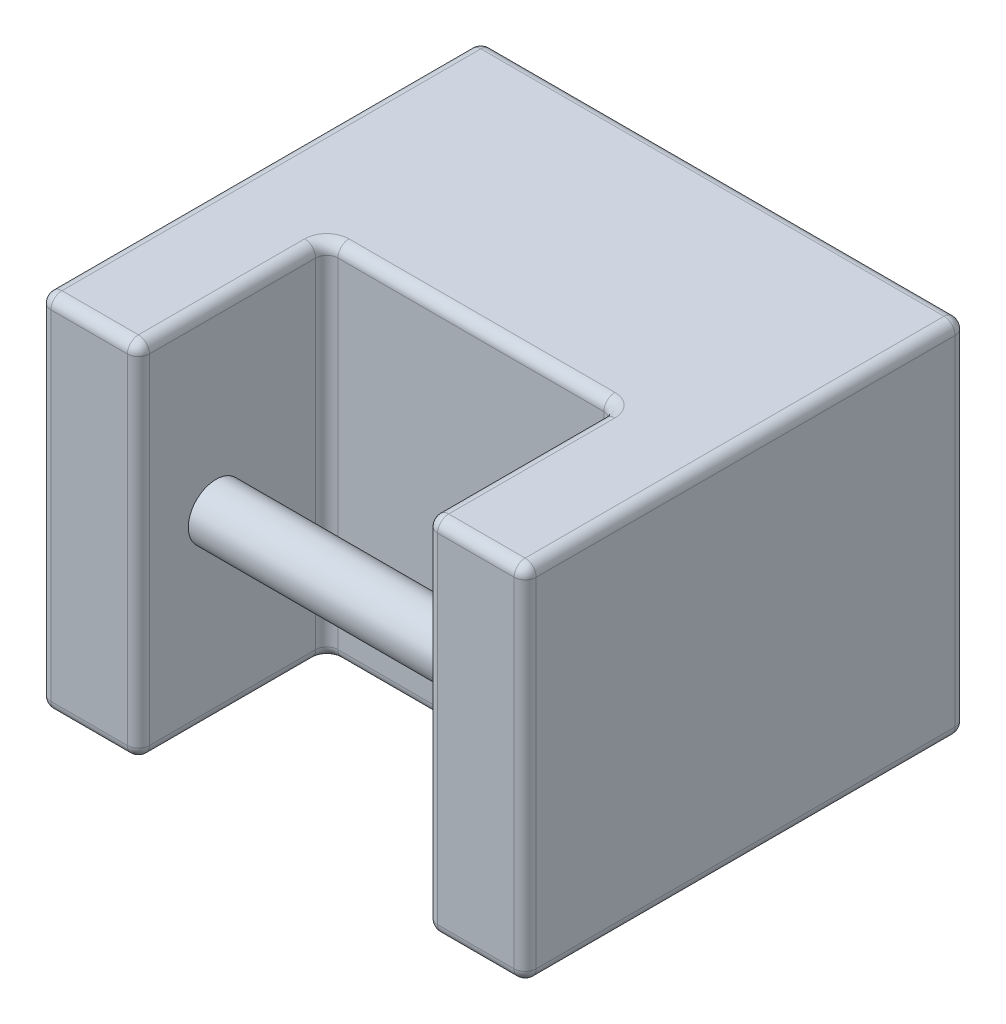
from build123d import *

# Parameters (mm, degrees)
SKETCH_1_W          = 219
SKETCH_1_H          = 163
EXTRUDE_1_DEPTH     = 199
SKETCH_2_W          = 130
SKETCH_2_H          = 170
CUT_EXTRUDE_1_DEPTH = 280.571547193
SKETCH_3_R          = 12.5
EXTRUDE_2_DEPTH     = 219
CUT_EXTRUDE_2_DEPTH = 0.1
FILLET_1_R          = 5


with BuildPart() as part:
    # 草图1 → 凸台-拉伸1 (new body)
    with BuildSketch(Plane.XY):
        Rectangle(SKETCH_1_W, SKETCH_1_H)
    extrude(amount=EXTRUDE_1_DEPTH)

    # 草图2 → 切除-拉伸1 (cut, through all)
    with BuildSketch(Plane.XZ.offset(81.5)):
        with Locations((0, 199)):
            Rectangle(SKETCH_2_W, SKETCH_2_H)
    extrude(amount=-CUT_EXTRUDE_1_DEPTH, mode=Mode.SUBTRACT)

    # 草图3 → 凸台-拉伸2 (add)
    with BuildSketch(Plane(origin=(109.5, 0, 0), x_dir=(0, 0, -1), z_dir=(1, 0, 0))):
        with Locations((-164, 0)):
            Circle(SKETCH_3_R)
    extrude(amount=-EXTRUDE_2_DEPTH)

    # 草图4 → 切除-拉伸2 (cut)
    # profile 1 of 4: a face of its own
    with BuildSketch(Plane.XZ.offset(81.5)):
        with BuildLine():
            Line((-46.175579134, 64.110809301), (-47.262304044, 64.110809301))
            add(Edge.make_bspline(
                [(-47.262304044, 64.110809301), (-47.284695529, 64.455227229), (-47.327383122, 65.111832742), (-47.371430886, 66.049536662), (-47.390032483, 66.891480143), (-47.408667005, 67.917907894), (-47.379927877, 69.212363046), (-47.302760911, 70.2549966), (-47.262304044, 70.80162541)],
                knots=[0, 0, 0, 0, 0.927540379, 1.768282303, 2.522502339, 3.190652681, 4.527123766, 6, 6, 6, 6], degree=3))
            add(Edge.make_bspline(
                [(-47.262304044, 70.80162541), (-47.234305367, 71.206857947), (-47.180159135, 71.99053123), (-47.037259081, 73.1199956), (-46.871880412, 74.166629537), (-46.656872478, 75.151066027), (-46.366361336, 76.11443546), (-45.952787301, 77.083419097), (-45.436982556, 78.091205736), (-44.827572962, 79.102519241), (-44.158906712, 80.056774708), (-43.408356598, 80.833306827), (-42.622844878, 81.425181075), (-41.787079057, 81.777436444), (-40.984622793, 81.996489034), (-40.25284843, 82.16879724), (-39.595254435, 82.289217385), (-39.179786853, 82.302068817), (-38.984017234, 82.308124452)],
                knots=[0, 0, 0, 0, 1.238521709, 2.395159043, 3.470603583, 4.46912877, 5.466066804, 6.534123646, 7.677244524, 8.916145015, 10.13365226, 11.221244199, 12.198275335, 13.109907183, 13.966820176, 14.733954848, 15.403435577, 16, 16, 16, 16], degree=3))
            add(Edge.make_bspline(
                [(-38.984017234, 82.308124452), (-38.734528731, 82.289728995), (-38.241547162, 82.253380141), (-37.51638493, 82.084965931), (-36.81602706, 81.842137789), (-35.9202457, 81.409566061), (-34.872773594, 80.731353242), (-33.981653898, 79.840747477), (-33.36502437, 79.025514382), (-32.930669333, 78.331687985), (-32.545762228, 77.556934341), (-32.062389328, 76.431190935), (-31.556714056, 74.937319176), (-31.192046889, 73.050548806), (-30.958231299, 71.091221763), (-30.851253207, 69.088199463), (-30.831361784, 67.104919224), (-30.947815118, 65.811456017), (-31.004047065, 65.186880045)],
                knots=[0, 0, 0, 0, 0.570779476, 1.127842599, 1.694919432, 2.261066821, 3.397481896, 4.527710891, 5.118384485, 5.730727279, 6.394748858, 7.092559246, 8.529363642, 9.986910621, 11.474321506, 13.03467297, 14.568129345, 16, 16, 16, 16], degree=3))
            add(Edge.make_bspline(
                [(-31.004047065, 65.186880045), (-31.118038133, 64.544419362), (-31.347721031, 63.249912384), (-31.842430831, 61.691343831), (-32.303803806, 60.50643007), (-32.689535826, 59.71241715), (-33.101686684, 59.009494464), (-33.69765435, 58.178218744), (-34.607774823, 57.234627881), (-35.451149938, 56.601844921), (-35.894309158, 56.269343288)],
                knots=[0, 0, 0, 0, 1.490916612, 3.004077927, 3.729534125, 4.397912905, 5.020560084, 5.590839424, 6.734084393, 8, 8, 8, 8], degree=3))
            Line((-35.894309158, 56.269343288), (-39.420838031, 54.04262264))
            add(Edge.make_bspline(
                [(-39.420838031, 54.04262264), (-39.870223805, 53.737540289), (-40.722344995, 53.159045928), (-41.860162032, 52.214102588), (-42.815169182, 51.218444241), (-43.537013387, 50.117540691), (-44.097654981, 48.984314995), (-44.595486873, 47.846445605), (-44.971324645, 46.592251649), (-45.238635077, 45.468082304), (-45.420931948, 44.523949177), (-45.5122481, 43.865490597), (-45.586430112, 43.283536846), (-45.595838875, 42.919867999), (-45.600254182, 42.749206915)],
                knots=[0, 0, 0, 0, 1.453572249, 2.75625039, 3.953730064, 5.132566341, 6.263730064, 7.337486329, 8.453238547, 9.76321854, 10.430854957, 11.026567013, 11.543191201, 12, 12, 12, 12], degree=3))
            Line((-45.600254182, 42.749206915), (-45.749412503, 39.734077999))
            Line((-45.749412503, 39.734077999), (-32.879180242, 40.160244631))
            add(Edge.make_bspline(
                [(-32.879180242, 40.160244631), (-32.714033413, 40.169478411), (-32.423969972, 40.185696598), (-32.145201196, 40.489602117), (-32.083150485, 40.860670985), (-31.973045369, 41.317075011), (-31.891189756, 41.971289458), (-31.828043873, 42.468808797), (-31.792455333, 42.749206915)],
                knots=[0, 0, 0, 0, 0.925905201, 1.626257371, 2.181371879, 3.087088273, 4.358305093, 6, 6, 6, 6], degree=3))
            Line((-31.792455333, 42.749206915), (-31.504792857, 49.013856393))
            Line((-31.504792857, 49.013856393), (-30.503301274, 49.013856393))
            Line((-30.503301274, 49.013856393), (-30.141059637, 39.520994684))
            add(Edge.make_bspline(
                [(-30.141059637, 39.520994684), (-30.128949704, 39.336443108), (-30.107769418, 39.013662207), (-30.09745914, 38.586669733), (-30.097167317, 38.289347982), (-30.101664013, 38.049290835), (-30.178981015, 37.83940434), (-30.250824055, 37.595866927), (-30.531077026, 37.458279763), (-30.933920777, 37.414257921), (-31.546153704, 37.351911123), (-32.026665824, 37.35589873), (-32.30385529, 37.358199031)],
                knots=[0, 0, 0, 0, 1.385018147, 2.4223982, 3.193529914, 3.619812046, 4.200562765, 4.878496499, 5.402948042, 6.404258339, 7.925751149, 10, 10, 10, 10], degree=3))
            Line((-32.30385529, 37.358199031), (-46.612399931, 36.995957394))
            add(Edge.make_bspline(
                [(-46.612399931, 36.995957394), (-46.786334778, 36.995448554), (-47.129173205, 36.994445592), (-47.480501686, 37.335359512), (-47.627982145, 37.752704424), (-47.701795526, 38.243585785), (-47.751237486, 38.894822827), (-47.774986356, 40.01491052), (-47.724212032, 41.608623187), (-47.609844313, 42.923686402), (-47.54996652, 43.612194343)],
                knots=[0, 0, 0, 0, 0.556373901, 1.096654043, 1.476064089, 2.012759395, 2.73145082, 3.635924119, 5.715166189, 8, 8, 8, 8], degree=3))
            add(Edge.make_bspline(
                [(-47.54996652, 43.612194343), (-47.49682995, 44.014075504), (-47.394470471, 44.788238124), (-47.186349679, 45.902605686), (-46.964459175, 46.936988246), (-46.723649417, 47.890759994), (-46.457807283, 48.758896247), (-46.167641338, 49.540403143), (-45.866839611, 50.2478672), (-45.415019829, 51.048194182), (-44.840792051, 51.92057754), (-44.18763949, 52.861216805), (-43.558780776, 53.659131507), (-42.736831783, 54.53696629), (-41.624070216, 55.495131695), (-40.68927971, 56.196724159), (-40.209246298, 56.557005764)],
                knots=[0, 0, 0, 0, 1.103491021, 2.125706759, 3.085324024, 3.98349739, 4.803138144, 5.555704107, 6.252741852, 6.89323317, 8.054555834, 9.09539633, 10.010480884, 10.817709087, 12.365830683, 14, 14, 14, 14], degree=3))
            Line((-40.209246298, 56.557005764), (-37.258042378, 58.432138941))
            add(Edge.make_bspline(
                [(-37.258042378, 58.432138941), (-37.021766931, 58.589229217), (-36.568357245, 58.890683531), (-35.942102174, 59.370623255), (-35.408196237, 59.868594849), (-34.948093501, 60.405971236), (-34.531585589, 61.027791923), (-34.18952402, 61.802881664), (-33.827902906, 62.715862756), (-33.406272758, 64.136290739), (-32.971541613, 66.011130793), (-32.804889953, 68.327569523), (-32.893916774, 70.674049454), (-33.166088544, 72.231478226), (-33.305346874, 73.028346058)],
                knots=[0, 0, 0, 0, 0.635613896, 1.219735276, 1.765761318, 2.268061313, 2.802129131, 3.435697723, 4.161225462, 5.001884758, 6.75303811, 8.46119913, 10.189351173, 12, 12, 12, 12], degree=3))
            add(Edge.make_bspline(
                [(-33.305346874, 73.028346058), (-33.410280385, 73.434588923), (-33.614935579, 74.226897411), (-34.00228901, 75.368248672), (-34.503694299, 76.407763964), (-35.040373106, 77.378830886), (-35.712730211, 78.228849948), (-36.608320003, 78.839332719), (-37.666337824, 79.247426369), (-38.440251193, 79.319289305), (-38.845513079, 79.356920531)],
                knots=[0, 0, 0, 0, 1.101106684, 2.147523679, 3.156537618, 4.125318695, 5.058520457, 5.968677808, 6.93629249, 8, 8, 8, 8], degree=3))
            add(Edge.make_bspline(
                [(-38.845513079, 79.356920531), (-39.058833022, 79.359104481), (-39.484314601, 79.363460524), (-40.118050629, 79.267356216), (-40.73444623, 79.06585168), (-41.544137897, 78.700635873), (-42.479752888, 78.020337667), (-43.464558056, 76.993896603), (-44.276865724, 75.740589714), (-44.902280411, 74.288235628), (-45.372545696, 72.633608399), (-45.754309045, 70.77922078), (-46.004985863, 68.701556909), (-46.075020682, 67.247348321), (-46.11165414, 66.48668827)],
                knots=[0, 0, 0, 0, 0.469335518, 0.936122588, 1.403629858, 1.893624907, 2.887406355, 3.927357629, 5.011993806, 6.157121359, 7.396943717, 8.794309501, 10.323183677, 12, 12, 12, 12], degree=3))
            Line((-46.11165414, 66.48668827), (-46.175579134, 64.110809301))
        make_face()
    # profile 2 of 4: a face of its own
    with BuildSketch(Plane.XZ.offset(81.5)):
        with BuildLine():
            add(Edge.make_bspline(
                [(-18.325589789, 80.081403804), (-18.158067889, 80.099069184), (-17.867814236, 80.129676772), (-17.583023962, 80.193092891), (-17.46260236, 80.219907959)],
                knots=[0, 0, 0, 0, 1.154313806, 2, 2, 2, 2], degree=3))
            Line((-17.46260236, 80.219907959), (-15.94971082, 80.294487119))
            Line((-15.94971082, 80.294487119), (-13.14766522, 80.72065375))
            Line((-13.14766522, 80.72065375), (-10.771786251, 81.008316227))
            add(Edge.make_bspline(
                [(-10.771786251, 81.008316227), (-10.549834253, 81.044199029), (-10.083368011, 81.119612254), (-9.640301504, 81.284254825), (-9.408053032, 81.370557863)],
                knots=[0, 0, 0, 0, 0.951631555, 2, 2, 2, 2], degree=3))
            Line((-9.408053032, 81.370557863), (-8.331982288, 81.80737866))
            add(Edge.make_bspline(
                [(-8.331982288, 81.80737866), (-8.221259294, 81.848468111), (-8.026998699, 81.920558479), (-7.779152006, 82.033922873), (-7.600681802, 82.106404392), (-7.504518875, 82.144787018), (-7.46899486, 82.158966131)],
                knots=[0, 0, 0, 0, 1.520021181, 2.666837392, 3.507509911, 4, 4, 4, 4], degree=3))
            Line((-7.46899486, 82.158966131), (-6.819090747, 82.595786928))
            Line((-6.819090747, 82.595786928), (-4.730874255, 80.507570435))
            add(Edge.make_bspline(
                [(-4.730874255, 80.507570435), (-4.652617732, 80.403029226), (-4.515614581, 80.220009655), (-4.464885417, 79.906562678), (-4.531781369, 79.678797758), (-4.608088804, 79.478343419), (-4.823668642, 79.357581503), (-4.992200112, 79.357168084), (-5.093115891, 79.356920531)],
                knots=[0, 0, 0, 0, 1.452844315, 2.54348448, 3.406058373, 4.120848162, 4.874773518, 6, 6, 6, 6], degree=3))
            Line((-5.093115891, 79.356920531), (-18.474748109, 77.492441519))
            Line((-18.474748109, 77.492441519), (-18.687831425, 62.885580237))
            add(Edge.make_bspline(
                [(-18.687831425, 62.885580237), (-18.415519386, 63.216686915), (-17.913203799, 63.827456996), (-17.166646563, 64.702293614), (-16.299051143, 65.445476686), (-15.408407178, 65.925340381), (-14.573308457, 66.265730738), (-13.833397229, 66.439006007), (-13.016029428, 66.547994775), (-12.444890011, 66.55670948), (-12.146173637, 66.56126743)],
                knots=[0, 0, 0, 0, 1.30943776, 2.415431215, 3.508265892, 4.775479805, 5.486396256, 6.257089544, 7.088425914, 8, 8, 8, 8], degree=3))
            add(Edge.make_bspline(
                [(-12.146173637, 66.56126743), (-11.850759697, 66.542124993), (-11.292369702, 66.50594205), (-10.513812793, 66.368336052), (-9.837782661, 66.17457157), (-9.066300947, 65.777470107), (-8.164901377, 65.089902351), (-7.315161048, 64.249454796), (-6.653768927, 63.4350765), (-6.166144531, 62.7353184), (-5.760733979, 61.934848821), (-5.373958037, 61.07316096), (-5.029392716, 60.12783738), (-4.744909919, 59.090612548), (-4.512319647, 57.962156586), (-4.273347482, 56.300461304), (-4.062087885, 54.051281343), (-4.032477845, 52.203590232), (-4.017045148, 51.24057704)],
                knots=[0, 0, 0, 0, 0.737858689, 1.39469691, 1.969129469, 2.484137971, 3.548991738, 4.782985237, 5.456749125, 6.164369648, 6.905359031, 7.690566505, 8.520047268, 9.411980184, 10.370982938, 11.392008999, 13.598323608, 16, 16, 16, 16], degree=3))
            add(Edge.make_bspline(
                [(-4.017045148, 51.24057704), (-4.034275559, 50.81084804), (-4.067606108, 49.979579225), (-4.124500387, 48.774535581), (-4.222994822, 47.655764268), (-4.374612225, 46.310428438), (-4.609524672, 44.769307831), (-5.022043521, 43.060079951), (-5.590200713, 41.485110392), (-6.34914135, 40.066869005), (-7.207867818, 38.828096925), (-8.126935444, 37.8381069), (-9.07554885, 37.118143656), (-10.086205576, 36.664618535), (-11.189580495, 36.462020568), (-11.953724692, 36.434981898), (-12.359256952, 36.420632442)],
                knots=[0, 0, 0, 0, 0.953497838, 1.844448518, 2.674189816, 3.442807412, 4.845957472, 6.127295929, 7.335424679, 8.547012004, 9.682888764, 10.668703604, 11.530079681, 12.305522429, 13.100738679, 14, 14, 14, 14], degree=3))
            add(Edge.make_bspline(
                [(-12.359256952, 36.420632442), (-12.845847817, 36.412221719), (-13.748332263, 36.396622277), (-15.045466151, 36.551720564), (-16.222134768, 36.977541579), (-17.341193965, 37.627824674), (-18.38687357, 38.543904269), (-19.287442939, 39.665966614), (-20.006053869, 40.87890223), (-20.526577409, 42.144616863), (-20.845108203, 43.511116014), (-21.116765865, 44.998969527), (-21.298855308, 46.573406535), (-21.284001259, 47.635510138), (-21.276793709, 48.150868965)],
                knots=[0, 0, 0, 0, 1.038316962, 1.925775792, 2.769505923, 3.689817589, 4.672983852, 5.718137725, 6.747565775, 7.672204827, 8.626195073, 9.735182009, 10.901054531, 12, 12, 12, 12], degree=3))
            Line((-21.276793709, 48.150868965), (-21.202214549, 50.164506297))
            Line((-21.202214549, 50.164506297), (-20.413806281, 50.164506297))
            add(Edge.make_bspline(
                [(-20.413806281, 50.164506297), (-20.380985084, 49.762974742), (-20.316081702, 48.968952635), (-20.170997347, 47.779034239), (-19.935096113, 46.571403487), (-19.64764181, 45.349588354), (-19.269555068, 44.196951166), (-18.866880502, 43.133219331), (-18.291034248, 42.165121278), (-17.591133785, 41.196836968), (-16.690112565, 40.303077277), (-15.792357244, 39.683827125), (-14.971126501, 39.330462405), (-14.269392617, 39.136665365), (-13.484310653, 39.037347465), (-12.934826781, 39.019136524), (-12.646919428, 39.009594726)],
                knots=[0, 0, 0, 0, 1.11825376, 2.211328589, 3.324923754, 4.532299777, 5.691974021, 6.691431964, 7.680579644, 8.808308283, 10.000254076, 11.186807161, 11.80939407, 12.474247533, 13.200567339, 14, 14, 14, 14], degree=3))
            add(Edge.make_bspline(
                [(-12.646919428, 39.009594726), (-12.308624975, 39.010982365), (-11.626027737, 39.013782286), (-10.768298967, 39.217351311), (-10.092994387, 39.538334006), (-9.569595409, 39.914663638), (-9.022859722, 40.392893829), (-8.494899271, 40.999238521), (-7.980375842, 41.67348538), (-7.526823442, 42.412676229), (-7.164202257, 43.208608777), (-6.78189874, 44.35470686), (-6.426708555, 45.907214774), (-6.101058792, 47.905909529), (-5.931470664, 50.090616832), (-5.947697455, 51.606146519), (-5.956103319, 52.391226945)],
                knots=[0, 0, 0, 0, 0.849390509, 1.713866746, 2.18933602, 2.722107664, 3.329685584, 4.012931591, 4.740083059, 5.461671267, 6.189151886, 6.934940173, 8.497098365, 10.188936476, 12.025778447, 14, 14, 14, 14], degree=3))
            add(Edge.make_bspline(
                [(-5.956103319, 52.391226945), (-5.980001839, 52.849716543), (-6.025647689, 53.725425486), (-6.161840287, 54.974767194), (-6.301400043, 56.09959077), (-6.542482789, 57.414792231), (-6.933527128, 58.918965704), (-7.493393613, 60.314421284), (-8.035184525, 61.321921607), (-8.479199448, 61.990315509), (-8.986901777, 62.561268114), (-9.540277774, 63.044256096), (-10.140959515, 63.42930169), (-10.773599519, 63.722934896), (-11.447456177, 63.90910714), (-11.910676491, 63.951004762), (-12.146173637, 63.972305146)],
                knots=[0, 0, 0, 0, 1.343436322, 2.565945237, 3.677305729, 4.659990038, 6.477828082, 8.216935171, 9.044830502, 9.823221578, 10.559528994, 11.274319052, 11.966299338, 12.640726254, 13.308957145, 14, 14, 14, 14], degree=3))
            add(Edge.make_bspline(
                [(-12.146173637, 63.972305146), (-12.402389443, 63.964463156), (-12.900449292, 63.949219051), (-13.625843242, 63.820438209), (-14.297835647, 63.59506149), (-15.102364232, 63.199648683), (-15.983876685, 62.616294761), (-16.84061159, 61.81721237), (-17.511586101, 61.00764944), (-17.818887879, 60.429770416), (-17.963348152, 60.158113797)],
                knots=[0, 0, 0, 0, 0.840347904, 1.633558669, 2.40744423, 3.157989381, 4.570423979, 5.856859538, 6.992525654, 8, 8, 8, 8], degree=3))
            Line((-17.963348152, 60.158113797), (-18.474748109, 59.145968048))
            Line((-18.474748109, 59.145968048), (-18.613252265, 58.219055626))
            add(Edge.make_bspline(
                [(-18.613252265, 58.219055626), (-18.621439676, 58.091740713), (-18.635813223, 57.868230877), (-18.684271726, 57.570481701), (-18.713695284, 57.386948894), (-18.738610555, 57.220768354), (-18.902990872, 57.240942909), (-19.062460892, 57.390382837), (-19.34713145, 57.61998701), (-19.562918109, 57.816360325), (-19.689323008, 57.93139315)],
                knots=[0, 0, 0, 0, 1.417361355, 2.488272572, 3.242975776, 3.665551287, 3.979432497, 4.77388376, 6.110184861, 8, 8, 8, 8], degree=3))
            Line((-19.689323008, 57.93139315), (-21.202214549, 59.145968048))
            add(Edge.make_bspline(
                [(-21.202214549, 59.145968048), (-21.331885588, 59.263906811), (-21.533174222, 59.446983407), (-21.754320494, 59.793740616), (-21.589774669, 60.160041619), (-21.443547392, 60.381045438), (-21.35137287, 60.520355434)],
                knots=[0, 0, 0, 0, 1.303116375, 2.022830373, 2.753688992, 4, 4, 4, 4], degree=3))
            Line((-21.35137287, 60.520355434), (-20.552310436, 61.596426178))
            Line((-20.552310436, 61.596426178), (-20.413806281, 69.28873387))
            Line((-20.413806281, 69.28873387), (-20.339227121, 74.828900075))
            add(Edge.make_bspline(
                [(-20.339227121, 74.828900075), (-20.339218801, 75.034880773), (-20.339200872, 75.478804691), (-20.339357664, 76.1890794), (-20.338649565, 76.988155426), (-20.341593292, 77.833329406), (-20.331402562, 78.646900599), (-20.360316484, 79.339118856), (-20.373464859, 79.872624871), (-20.401927345, 80.170265552), (-20.413806281, 80.294487119)],
                knots=[0, 0, 0, 0, 0.904131945, 1.948560225, 3.117696361, 4.41154035, 5.658618894, 6.687930963, 7.452402571, 8, 8, 8, 8], degree=3))
            Line((-20.413806281, 80.294487119), (-20.701468757, 82.521207767))
            Line((-20.701468757, 82.521207767), (-19.976985484, 82.808870243))
            add(Edge.make_bspline(
                [(-19.976985484, 82.808870243), (-19.87146288, 82.542378625), (-19.694044251, 82.094317493), (-19.44490524, 81.495916265), (-19.130817624, 81.046067726), (-18.890389529, 80.79197913), (-18.762410586, 80.656728756)],
                knots=[0, 0, 0, 0, 1.37928148, 2.31903137, 3.105226912, 4, 4, 4, 4], degree=3))
            Line((-18.762410586, 80.656728756), (-18.325589789, 80.081403804))
        make_face()
    # profile 3 of 4: a face of its own
    with BuildSketch(Plane.XZ.offset(81.5)):
        with BuildLine():
            Line((4.921799941, 58.432138941), (15.490732393, 74.253575123))
            add(Edge.make_bspline(
                [(15.490732393, 74.253575123), (15.554710334, 74.356529581), (15.71962897, 74.621919632), (16.018630384, 75.10747981), (16.399192196, 75.788206484), (16.860424271, 76.596116923), (17.339791321, 77.442717093), (17.754863659, 78.233852529), (18.075401383, 78.922709582), (18.421764934, 79.71685337), (18.748104291, 80.762004049), (18.922927692, 81.627841083), (19.017261266, 82.095041136)],
                knots=[0, 0, 0, 0, 0.420080696, 1.08285973, 1.975895696, 3.122344224, 4.307000813, 5.347403028, 6.217326357, 6.939704131, 8.348684182, 10, 10, 10, 10], degree=3))
            Line((19.017261266, 82.095041136), (19.379502903, 83.821015992))
            Line((19.379502903, 83.821015992), (20.317069491, 83.821015992))
            Line((20.317069491, 83.821015992), (20.892394443, 77.417862359))
            add(Edge.make_bspline(
                [(20.892394443, 77.417862359), (20.70921963, 77.300008195), (20.359870118, 77.075237693), (19.947691691, 76.752062058), (19.607991629, 76.465521362), (19.326685839, 76.156483303), (18.972905135, 75.789179516), (18.451890885, 75.208218537), (17.811559071, 74.467241483), (17.364774002, 73.830984653), (17.152782255, 73.52909185)],
                knots=[0, 0, 0, 0, 0.961837198, 1.834408076, 2.312695353, 2.923075551, 3.677929009, 4.566716946, 6.370966884, 8, 8, 8, 8], degree=3))
            Line((17.152782255, 73.52909185), (12.038782681, 65.410617526))
            Line((12.038782681, 65.410617526), (19.091840427, 44.549760931))
            add(Edge.make_bspline(
                [(19.091840427, 44.549760931), (19.136524313, 44.410725178), (19.240752553, 44.086414715), (19.459267551, 43.54948495), (19.73761348, 42.885973768), (20.059836894, 42.143277843), (20.387705929, 41.399865766), (20.714949966, 40.758658149), (20.963876165, 40.227794199), (21.259160809, 39.690629552), (21.731072455, 39.121525408), (22.462425553, 38.597194511), (23.266135217, 38.156498776), (23.846818408, 38.00496918), (24.120606674, 37.933523983)],
                knots=[0, 0, 0, 0, 0.601283206, 1.402534455, 2.385877248, 3.565090634, 4.736842296, 5.731110854, 6.529151735, 7.151416212, 8.252576758, 9.536782906, 10.838609505, 12, 12, 12, 12], degree=3))
            Line((24.120606674, 37.933523983), (25.207331584, 37.645861507))
            Line((25.207331584, 37.645861507), (25.207331584, 36.420632442))
            Line((25.207331584, 36.420632442), (19.091840427, 36.420632442))
            add(Edge.make_bspline(
                [(19.091840427, 36.420632442), (19.041225843, 36.697488351), (18.936220546, 37.271855155), (18.793713122, 38.150767842), (18.644572252, 39.038658275), (18.472826292, 39.805725252), (18.272629577, 40.533091116), (18.020771934, 41.318483399), (17.694193575, 42.354279621), (17.434922148, 43.122613986), (17.29128641, 43.548269348)],
                knots=[0, 0, 0, 0, 0.916910572, 1.902227753, 2.90090532, 3.849675465, 4.461593695, 5.358203872, 6.536451397, 8, 8, 8, 8], degree=3))
            Line((17.29128641, 43.548269348), (10.600470301, 63.396980194))
            Line((10.600470301, 63.396980194), (4.921799941, 54.831030908))
            Line((4.921799941, 54.831030908), (4.921799941, 42.397619444))
            Line((4.921799941, 42.397619444), (4.708716625, 37.219694876))
            add(Edge.make_bspline(
                [(4.708716625, 37.219694876), (4.696644373, 36.917684018), (4.674322112, 36.359249242), (4.613113165, 35.588010017), (4.52723456, 34.950720202), (4.440129094, 34.447386298), (4.327091741, 34.070826688), (4.25291746, 33.841031486), (4.163878987, 33.663092854), (4.085013791, 33.685666418), (4.058812513, 33.693166003)],
                knots=[0, 0, 0, 0, 1.962828299, 3.629378072, 5.025620302, 6.129446706, 6.969082562, 7.509057143, 7.836894713, 8, 8, 8, 8], degree=3))
            add(Edge.make_bspline(
                [(4.058812513, 33.693166003), (4.026558205, 33.702839789), (3.947070941, 33.726679791), (3.786599259, 33.816904592), (3.619426428, 34.105269073), (3.431978569, 34.519746787), (3.257380749, 34.982940189), (3.213477019, 35.294054311), (3.195825085, 35.419140859)],
                knots=[0, 0, 0, 0, 0.30186791, 0.743920916, 1.609509567, 3.189637424, 4.870065584, 6, 6, 6, 6], degree=3))
            Line((3.195825085, 35.419140859), (2.545920972, 38.008103143))
            add(Edge.make_bspline(
                [(2.545920972, 38.008103143), (2.469037527, 38.273675865), (2.33517255, 38.736075625), (2.191368071, 39.334058598), (2.09342505, 39.720303353), (2.02252471, 40.009187997), (2.134948867, 40.332248656), (2.292462673, 40.75979099), (2.513773204, 41.240571842), (2.667495748, 41.767086257), (2.792158699, 42.379189545), (2.882629167, 43.142003314), (2.965432349, 43.998129045), (3.010401656, 44.755399149), (3.041601698, 45.440905654), (3.04587781, 46.133711033), (3.06121241, 47.007265696), (3.058696816, 47.650110979), (3.05732093, 48.001710644)],
                knots=[0, 0, 0, 0, 1.303234359, 2.269115785, 2.890039559, 3.195386403, 3.64187597, 4.446796483, 5.369688572, 6.121366675, 7.027109972, 8.309771923, 9.738354317, 11.079598601, 11.883474893, 12.971242357, 14.343442508, 16, 16, 16, 16], degree=3))
            Line((3.05732093, 48.001710644), (3.05732093, 76.054129139))
            add(Edge.make_bspline(
                [(3.05732093, 76.054129139), (3.058937002, 76.249482289), (3.062405144, 76.66871632), (3.032195591, 77.339640958), (3.016328244, 78.099895388), (2.983463274, 78.916701895), (2.947857766, 79.719925988), (2.888264127, 80.436539257), (2.846936421, 81.035654231), (2.739384226, 81.674095377), (2.6044075, 82.400190587), (2.47350716, 82.962025772), (2.407416817, 83.24569104)],
                knots=[0, 0, 0, 0, 0.809324544, 1.736836047, 2.782014883, 3.960041647, 5.124015164, 6.112661131, 6.939978743, 7.610116978, 8.79337068, 10, 10, 10, 10], degree=3))
            Line((2.407416817, 83.24569104), (2.119754341, 84.396340944))
            Line((2.119754341, 84.396340944), (2.769658453, 85.110170051))
            Line((2.769658453, 85.110170051), (5.710208208, 80.869812071))
            add(Edge.make_bspline(
                [(5.710208208, 80.869812071), (5.625060388, 80.636623731), (5.474307068, 80.223766227), (5.33086489, 79.708836668), (5.255810786, 79.300685393), (5.191502634, 78.924751253), (5.131992581, 78.451214914), (5.020709041, 77.666116858), (4.935044505, 76.517532167), (4.926423409, 75.557074198), (4.921799941, 75.04198339)],
                knots=[0, 0, 0, 0, 1.007435709, 1.783654327, 2.165285696, 2.691347983, 3.331434253, 4.102011478, 5.909520124, 8, 8, 8, 8], degree=3))
            Line((4.921799941, 75.04198339), (4.921799941, 58.432138941))
        make_face()
    # profile 4 of 4: a face of its own
    with BuildSketch(Plane.XZ.offset(81.5)):
        with BuildLine():
            add(Edge.make_bspline(
                [(31.482635227, 43.473690188), (31.27955943, 43.686002828), (30.886965919, 44.096453338), (30.309227881, 44.724789626), (29.810271478, 45.472466011), (29.432338981, 46.195483018), (29.193372218, 46.897393399), (29.08581674, 47.518478739), (29.016595541, 48.206151162), (29.026814062, 48.686941616), (29.032177098, 48.939277232)],
                knots=[0, 0, 0, 0, 1.135227858, 2.194663746, 3.290419675, 4.597098472, 5.334524358, 6.144311446, 7.026069861, 8, 8, 8, 8], degree=3))
            add(Edge.make_bspline(
                [(29.032177098, 48.939277232), (29.037243809, 49.077947958), (29.048844321, 49.395442142), (29.122546347, 49.92746583), (29.215980954, 50.578259866), (29.345187317, 51.313107581), (29.524357555, 52.056580056), (29.752677546, 52.731797669), (30.035832773, 53.302872539), (30.28734517, 53.609578544), (30.406564484, 53.754960164)],
                knots=[0, 0, 0, 0, 0.654199989, 1.497826532, 2.530782161, 3.75645407, 5.016003174, 6.133900605, 7.115450797, 8, 8, 8, 8], degree=3))
            Line((30.406564484, 53.754960164), (31.269551912, 54.767105913))
            add(Edge.make_bspline(
                [(31.269551912, 54.767105913), (31.224247683, 55.004573241), (31.12469879, 55.526370218), (31.044607473, 56.224877538), (31.02296002, 56.880038652), (31.008885149, 57.469695169), (31.024400722, 58.137493785), (31.038429747, 58.609728029), (31.04581443, 58.858305572)],
                knots=[0, 0, 0, 0, 1.058978104, 2.326937265, 3.074372785, 3.930208275, 4.910490401, 6, 6, 6, 6], degree=3))
            add(Edge.make_bspline(
                [(31.04581443, 58.858305572), (31.097623091, 59.64083657), (31.206269291, 61.281856042), (31.545248328, 63.333234487), (31.929484201, 64.964433076), (32.304237563, 66.063420072), (32.733673856, 67.008882394), (33.240930469, 67.802371562), (33.79985082, 68.443591898), (34.352836883, 68.99230812), (34.934157689, 69.411596783), (35.531522411, 69.725034402), (36.149911184, 69.957804567), (36.801400602, 70.085528358), (37.478801173, 70.16918383), (37.938805493, 70.157619966), (38.173451337, 70.151721298)],
                knots=[0, 0, 0, 0, 2.192107981, 4.596996022, 5.803717941, 6.874649363, 7.838769503, 8.700990397, 9.49701601, 10.213421854, 10.87492999, 11.492407865, 12.095666655, 12.715058206, 13.344557782, 14, 14, 14, 14], degree=3))
            add(Edge.make_bspline(
                [(38.173451337, 70.151721298), (38.433342703, 70.124400344), (38.924719189, 70.072744631), (39.609860163, 69.929310474), (40.194396702, 69.71817945), (40.530141884, 69.527466244), (40.68783446, 69.437892191)],
                knots=[0, 0, 0, 0, 1.188006793, 2.246163888, 3.176259408, 4, 4, 4, 4], degree=3))
            Line((40.68783446, 69.437892191), (41.401663567, 68.926492233))
            add(Edge.make_bspline(
                [(41.401663567, 68.926492233), (41.407464317, 69.235499103), (41.418940762, 69.84685123), (41.459124921, 70.764054758), (41.606677652, 71.685821597), (41.95200506, 72.563865702), (42.410239482, 73.349359835), (43.024591475, 73.954107125), (43.767415212, 74.332984674), (44.601208031, 74.455895818), (45.446746678, 74.392108646), (46.096083599, 74.090335944), (46.5423992, 73.715221237), (46.854603743, 73.327644353), (47.155154664, 72.852584332), (47.425530592, 72.296523652), (47.652819051, 71.678492539), (47.779104173, 71.006297088), (47.813398639, 70.299208776), (47.758390762, 69.821093206), (47.73023804, 69.576396346)],
                knots=[0, 0, 0, 0, 1.220883175, 2.415446381, 3.626374228, 4.887463441, 6.121814415, 7.193391314, 8.247467747, 9.356857997, 10.484810479, 11.551877781, 12.119506644, 12.776946908, 13.508632633, 14.336844638, 15.215450153, 16.101417479, 17.028316139, 18, 18, 18, 18], degree=3))
            Line((47.73023804, 69.576396346), (47.591733885, 67.136592382))
            Line((47.591733885, 67.136592382), (46.803325617, 67.136592382))
            add(Edge.make_bspline(
                [(46.803325617, 67.136592382), (46.796299777, 67.602053984), (46.783306867, 68.462833702), (46.712766041, 69.66863719), (46.528245664, 70.735174616), (46.145645396, 71.481776858), (45.784358002, 71.985551618), (45.461450313, 72.249155247), (45.097651888, 72.400227176), (44.716643548, 72.424067916), (44.338310613, 72.367286112), (43.996564497, 72.188849708), (43.712592687, 71.904347413), (43.397660416, 71.426295798), (43.130228818, 70.734012007), (43.085618261, 70.150551599), (43.063713429, 69.864058822)],
                knots=[0, 0, 0, 0, 2.046155389, 3.783962098, 5.315228281, 6.760814087, 7.429182933, 8.029107495, 8.568461224, 9.132564628, 9.687076702, 10.231828602, 10.795066816, 11.436060007, 12.741045187, 14, 14, 14, 14], degree=3))
            Line((43.063713429, 69.864058822), (42.989134269, 67.775842329))
            add(Edge.make_bspline(
                [(42.989134269, 67.775842329), (43.087408268, 67.491297053), (43.283256115, 66.924233741), (43.599394221, 66.077252343), (43.92019345, 65.196365166), (44.157115114, 64.217556931), (44.357648113, 63.105100958), (44.469252266, 61.828949853), (44.559526801, 60.383191129), (44.578142554, 58.794063439), (44.521544963, 57.111388519), (44.359722629, 55.977144579), (44.278288328, 55.40635586)],
                knots=[0, 0, 0, 0, 0.71690026, 1.428692973, 2.153581917, 2.947477765, 3.823539998, 4.843580718, 5.995878065, 7.273171307, 8.627770446, 10, 10, 10, 10], degree=3))
            add(Edge.make_bspline(
                [(44.278288328, 55.40635586), (44.145408177, 54.810826741), (43.887268456, 53.653921669), (43.292052549, 52.310933441), (42.710294811, 51.348545239), (42.174877917, 50.710477652), (41.558800401, 50.138978058), (40.870088839, 49.635573908), (40.111213855, 49.23739767), (39.291587707, 48.966943838), (38.418955727, 48.83774219), (37.825708947, 48.855601625), (37.523547224, 48.864698072)],
                knots=[0, 0, 0, 0, 1.760694636, 3.420414699, 4.218196339, 5.005669859, 5.819349166, 6.64294469, 7.465002697, 8.286483394, 9.127244941, 10, 10, 10, 10], degree=3))
            add(Edge.make_bspline(
                [(37.523547224, 48.864698072), (37.281438367, 48.884711153), (36.808031283, 48.923843693), (36.128729531, 49.061819566), (35.501995788, 49.263730733), (34.760468898, 49.618263167), (33.9578547, 50.156848344), (33.265874174, 50.754033701), (32.84126224, 51.22809966), (32.585992394, 51.484865894), (32.393516927, 51.658677414), (32.223118517, 51.790977255), (32.024699542, 51.89141344), (31.814676069, 51.962708787), (31.607649733, 51.953948928), (31.435608958, 51.855562378), (31.284135225, 51.656174169), (31.101961788, 51.401362108), (30.942958682, 51.056414685), (30.831788494, 50.631136574), (30.743177449, 50.13241775), (30.716198002, 49.401334885), (30.729564826, 48.527256238), (30.90325875, 47.872121447), (30.981889436, 47.575544013)],
                knots=[0, 0, 0, 0, 1.389982247, 2.717899094, 3.958906867, 5.150454775, 7.4119528, 9.472064838, 10.363960182, 11.054100822, 11.543795473, 11.848797427, 12.285375406, 12.813262824, 13.098656586, 13.444325468, 13.905316973, 14.520047047, 15.238655932, 16.062600394, 17.032018398, 18.131718583, 20.248841315, 22, 22, 22, 22], degree=3))
            add(Edge.make_bspline(
                [(30.981889436, 47.575544013), (31.116239762, 47.258164959), (31.379166219, 46.637047376), (32.006124381, 45.877708365), (32.693225376, 45.321186055), (33.376235999, 44.964136467), (34.003667078, 44.804260287), (34.394198813, 44.775818307), (34.572343303, 44.762844247)],
                knots=[0, 0, 0, 0, 1.275267421, 2.495725562, 3.613099993, 4.545863217, 5.336682702, 6, 6, 6, 6], degree=3))
            add(Edge.make_bspline(
                [(34.572343303, 44.762844247), (34.629111127, 44.753445781), (34.781195336, 44.728266761), (35.069682933, 44.773918315), (35.479785035, 44.788717978), (36.172287369, 44.906308396), (37.082895037, 45.024774432), (37.821419145, 45.042200325), (38.173451337, 45.050506723)],
                knots=[0, 0, 0, 0, 0.284831154, 0.763078757, 1.436417527, 2.328255033, 4.249789801, 6, 6, 6, 6], degree=3))
            add(Edge.make_bspline(
                [(38.173451337, 45.050506723), (38.661955233, 45.014306864), (39.620265371, 44.943292709), (40.979919098, 44.613276786), (42.19709826, 44.186928458), (43.262446058, 43.604025927), (44.215137298, 42.82774614), (44.948851305, 42.018320476), (45.540234423, 41.25238034), (45.933010748, 40.553150639), (46.316718231, 39.784370992), (46.627272049, 38.92076392), (46.8972931, 37.975500212), (47.103847758, 36.943481867), (47.200445221, 35.815180519), (47.219560457, 35.035720335), (47.229492248, 34.630732591)],
                knots=[0, 0, 0, 0, 1.321867056, 2.593139198, 3.768301051, 4.799433039, 5.857771464, 7.073624871, 7.745532227, 8.468243093, 9.23667695, 10.065782602, 10.943891018, 11.892655979, 12.905077493, 14, 14, 14, 14], degree=3))
            add(Edge.make_bspline(
                [(47.229492248, 34.630732591), (47.214332425, 34.211185869), (47.185740106, 33.419896059), (47.052397078, 32.307178502), (46.887840327, 31.336488434), (46.561198493, 30.295060918), (46.116468809, 29.218038686), (45.441149342, 28.142266649), (44.593186473, 27.269489368), (43.602524392, 26.503955324), (42.483354251, 25.849469515), (41.456282247, 25.44233195), (40.544601958, 25.246736148), (39.727787733, 25.156500687), (38.77752264, 25.115812841), (38.098883098, 25.130194216), (37.73663054, 25.137870882)],
                knots=[0, 0, 0, 0, 1.142923724, 2.155621406, 3.051120085, 3.81921888, 5.123680156, 6.215777864, 7.255826038, 8.420685455, 9.616932513, 10.777446025, 11.411176213, 12.151483715, 13.013276252, 14, 14, 14, 14], degree=3))
            add(Edge.make_bspline(
                [(37.73663054, 25.137870882), (37.360136743, 25.145517922), (36.652521129, 25.159890443), (35.650835872, 25.225392948), (34.779585646, 25.366772989), (34.004688376, 25.543658713), (33.294363916, 25.813293891), (32.606930547, 26.168530231), (31.909244791, 26.599767415), (31.217359979, 27.096356795), (30.585664657, 27.663209427), (30.016457205, 28.245816845), (29.573059196, 28.871835473), (29.07993289, 29.716378291), (28.662551567, 30.861213118), (28.309912552, 32.307660836), (28.161134621, 33.8686633), (28.215599704, 34.939755407), (28.243768831, 35.493720019)],
                knots=[0, 0, 0, 0, 1.112508247, 2.090946021, 2.961965061, 3.717692767, 4.434784848, 5.199560907, 6.000263941, 6.856435159, 7.711126724, 8.505204279, 9.256476823, 9.970877828, 11.389203505, 12.834548801, 14.362841125, 16, 16, 16, 16], degree=3))
            add(Edge.make_bspline(
                [(28.243768831, 35.493720019), (28.279571011, 35.88526085), (28.35230382, 36.68068347), (28.597439905, 37.904655931), (28.981800627, 39.202494298), (29.391952686, 40.333571526), (29.804662584, 41.233692992), (30.139657553, 41.850396032), (30.500961849, 42.382340958), (30.775936939, 42.681065902), (30.907310275, 42.823786075)],
                knots=[0, 0, 0, 0, 1.190472196, 2.418466835, 3.773629166, 5.288460201, 6.058662004, 6.771335989, 7.412987954, 8, 8, 8, 8], degree=3))
            Line((30.907310275, 42.823786075), (31.482635227, 43.473690188))
        make_face()
        with BuildLine():
            add(Edge.make_bspline(
                [(34.860005779, 42.536123599), (34.540080101, 42.451567134), (33.910930134, 42.285282586), (33.02901476, 41.835999105), (32.230948606, 41.166252781), (31.492559738, 40.286476175), (30.854789855, 39.160474356), (30.35829414, 37.851023581), (30.030461501, 36.411245007), (29.99003535, 35.417299842), (29.969743687, 34.918395067)],
                knots=[0, 0, 0, 0, 0.810367561, 1.593628642, 2.404698529, 3.350745018, 4.396900851, 5.563581589, 6.777054489, 8, 8, 8, 8], degree=3))
            add(Edge.make_bspline(
                [(29.969743687, 34.918395067), (29.997979121, 34.372798223), (30.05426677, 33.285144883), (30.390053803, 31.966023442), (30.780851074, 30.976423086), (31.159203657, 30.306060582), (31.58597484, 29.691695231), (32.073401153, 29.143254482), (32.635892343, 28.685617341), (33.246712599, 28.293086262), (33.925165586, 27.997972669), (34.892748941, 27.705626024), (36.146934011, 27.491301174), (37.160512823, 27.456427075), (37.662051379, 27.439170691)],
                knots=[0, 0, 0, 0, 1.600368429, 3.190352152, 3.966451411, 4.717585489, 5.443344749, 6.159157502, 6.862416535, 7.565057453, 8.283596545, 9.025344262, 10.528082347, 12, 12, 12, 12], degree=3))
            add(Edge.make_bspline(
                [(37.662051379, 27.439170691), (38.074118057, 27.427513433), (38.903621031, 27.404047012), (40.148177533, 27.516862444), (41.367447973, 27.801525194), (42.317740445, 28.243848642), (43.015194589, 28.71605348), (43.483306963, 29.174241782), (43.916296535, 29.700679753), (44.403440139, 30.492511911), (44.883504892, 31.49021116), (45.246275339, 32.697304687), (45.398223647, 33.902013056), (45.418461154, 34.712094449), (45.428938232, 35.131478383)],
                knots=[0, 0, 0, 0, 1.170474439, 2.35620127, 3.5406395, 4.70976499, 5.311533892, 5.925279885, 6.563502345, 7.243730732, 8.561615145, 9.698154275, 10.808320838, 12, 12, 12, 12], degree=3))
            add(Edge.make_bspline(
                [(45.428938232, 35.131478383), (45.393126447, 35.620039402), (45.323632983, 36.568101567), (44.994199244, 37.913180792), (44.540355152, 39.123322403), (43.932462774, 40.133769173), (43.292256213, 40.937263574), (42.585052015, 41.473345019), (41.855662823, 41.813684157), (41.118627247, 42.119843495), (40.351433222, 42.368830963), (39.566716362, 42.515850768), (38.757317129, 42.596848993), (37.914924487, 42.647044994), (37.051143901, 42.673139249), (36.226948721, 42.645596411), (35.497590006, 42.612765145), (35.05514769, 42.559580857), (34.860005779, 42.536123599)],
                knots=[0, 0, 0, 0, 1.554869659, 3.017254828, 4.38640183, 5.646962366, 6.75286635, 7.63128774, 8.439178323, 9.305102918, 10.169259116, 10.997408538, 11.837782229, 12.754062696, 13.680168395, 14.583699747, 15.375332041, 16, 16, 16, 16], degree=3))
        make_face(mode=Mode.SUBTRACT)
        with BuildLine():
            add(Edge.make_bspline(
                [(32.920947608, 57.782234829), (32.939107886, 57.430477862), (32.973848682, 56.757563225), (33.072522449, 55.802111439), (33.238564736, 54.952880064), (33.426570902, 54.193272578), (33.725455212, 53.51780057), (34.174404332, 52.945709392), (34.716670438, 52.421917715), (35.389196813, 52.018011372), (36.091691685, 51.673431897), (36.810003312, 51.467335813), (37.501814006, 51.342899436), (37.952855213, 51.367197467), (38.173451337, 51.379081196)],
                knots=[0, 0, 0, 0, 1.333206332, 2.550437202, 3.631333133, 4.606323181, 5.508545216, 6.401102465, 7.342527054, 8.3456511, 9.355865084, 10.295752966, 11.166483495, 12, 12, 12, 12], degree=3))
            add(Edge.make_bspline(
                [(38.173451337, 51.379081196), (38.52204719, 51.423436548), (39.175643233, 51.506600139), (40.045298487, 51.865862481), (40.779937199, 52.326915395), (41.43605727, 53.201378383), (42.01648506, 54.367412241), (42.462291225, 55.864481698), (42.660355607, 57.485397875), (42.687155241, 58.616372591), (42.701471792, 59.220547209)],
                knots=[0, 0, 0, 0, 0.831999244, 1.559948026, 2.223091418, 2.865680768, 4.127685039, 5.309152748, 6.562530545, 8, 8, 8, 8], degree=3))
            add(Edge.make_bspline(
                [(42.701471792, 59.220547209), (42.671117318, 59.810854766), (42.614055935, 60.920535184), (42.400224149, 62.496918595), (42.074709662, 63.93543132), (41.605634022, 65.022254482), (41.14459847, 65.82203512), (40.714619605, 66.331280346), (40.231053852, 66.768862542), (39.686375707, 67.103081971), (39.129415391, 67.356384315), (38.60196206, 67.57315524), (38.08879343, 67.679303334), (37.758285115, 67.701271792), (37.598126384, 67.711917335)],
                knots=[0, 0, 0, 0, 1.933407383, 3.634485592, 5.201671502, 6.74291797, 7.488329334, 8.214466674, 8.914176337, 9.613886, 10.294912499, 10.916529373, 11.47496849, 12, 12, 12, 12], degree=3))
            add(Edge.make_bspline(
                [(37.598126384, 67.711917335), (37.357933517, 67.682645722), (36.899524457, 67.626780732), (36.272187162, 67.391243443), (35.722191486, 67.084804095), (35.13778878, 66.535102032), (34.565194313, 65.748227468), (33.951967784, 64.74003679), (33.497692094, 63.547344112), (33.244152562, 62.4346819), (33.081836137, 61.498493478), (32.988911739, 60.844029217), (32.905754166, 60.27366184), (32.865502625, 59.604668982), (32.872798112, 58.783148972), (32.904381157, 58.126612155), (32.920947608, 57.782234829)],
                knots=[0, 0, 0, 0, 0.8422394, 1.607417306, 2.324424195, 3.027014691, 4.389157779, 5.712451409, 7.138340704, 8.82318486, 9.691954423, 10.456830622, 11.132287207, 11.704114076, 12.795724724, 14, 14, 14, 14], degree=3))
        make_face(mode=Mode.SUBTRACT)
    extrude(amount=-CUT_EXTRUDE_2_DEPTH, mode=Mode.SUBTRACT)

    # 圆角1
    fillet_1_edges = [part.edges().sort_by_distance(p)[0] for p in [
        (-109.5, 0, 199),
        (-87.25, 81.5, 199),
        (87.25, -81.5, 199),
        (-65, 0, 199),
        (65, 0, 199),
        (-87.25, -81.5, 199),
        (65, 81.5, 156.5),
        (0, 81.5, 114),
        (65, 0, 114),
        (-65, 81.5, 156.5),
        (-65, 0, 114),
        (-65, -81.5, 156.5),
        (0, -81.5, 114),
        (65, -81.5, 156.5),
        (109.5, 0, 199),
        (0, -81.5, 0),
        (-109.5, 0, 0),
        (0, 81.5, 0),
        (109.5, 0, 0),
        (109.5, -81.5, 99.5),
        (-109.5, -81.5, 99.5),
        (-109.5, 81.5, 99.5),
        (109.5, 81.5, 99.5),
        (87.25, 81.5, 199),
    ]]
    fillet(fillet_1_edges, radius=FILLET_1_R)


solid = part.part
